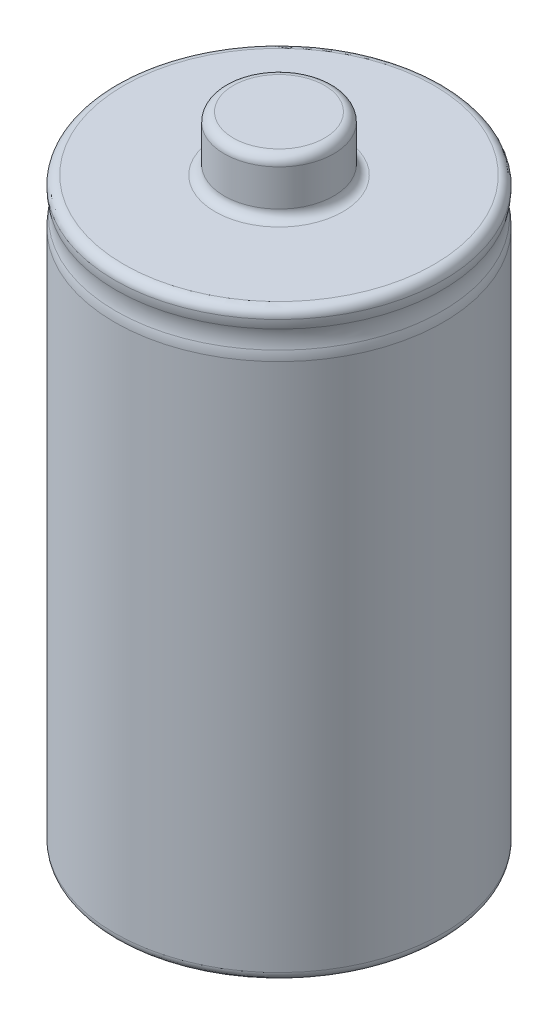
from build123d import *

# Parameters (mm, degrees)
FILLET1_R = 0.5


with BuildPart() as part:
    # Sketch1 → Revolve1 (revolve)
    with BuildSketch(Plane.XY, mode=Mode.PRIVATE) as revolve1_sk:
        Polygon((0, -17.5), (0, 17.5), (3, 17.5), (3, 14.5), (9, 14.5), (9, -17.5), align=None)
    revolve(revolve1_sk.sketch.rotate(Axis((0, -17.5, 0), (0, 1, 0)), 90), axis=Axis((0, -17.5, 0), (0, 1, 0)))

    # Fillet1
    fillet1_edges = [part.edges().sort_by_distance(p)[0] for p in [
        (0, -17.5, 9),
        (0, 14.5, 9),
        (0, 14.5, 3),
        (0, 17.5, 3),
    ]]
    fillet(fillet1_edges, radius=FILLET1_R)

    # Sketch2 → Cut-Revolve1 (revolve, cut)
    with BuildSketch(Plane.XY, mode=Mode.PRIVATE) as cut_revolve1_sk:
        with BuildLine():
            Line((9, 12), (9, 14))
            ThreePointArc((9, 14), (8.984059393, 13.747991415), (8.936491673, 13.5))
            ThreePointArc((8.936491673, 13.5), (8.872983346, 13), (8.936491673, 12.5))
            ThreePointArc((8.936491673, 12.5), (8.984059393, 12.252008585), (9, 12))
        make_face()
    revolve(cut_revolve1_sk.sketch.rotate(Axis((0, 17.5, 0), (0, -1, 0)), 90), axis=Axis((0, 17.5, 0), (0, -1, 0)), mode=Mode.SUBTRACT)


solid = part.part
